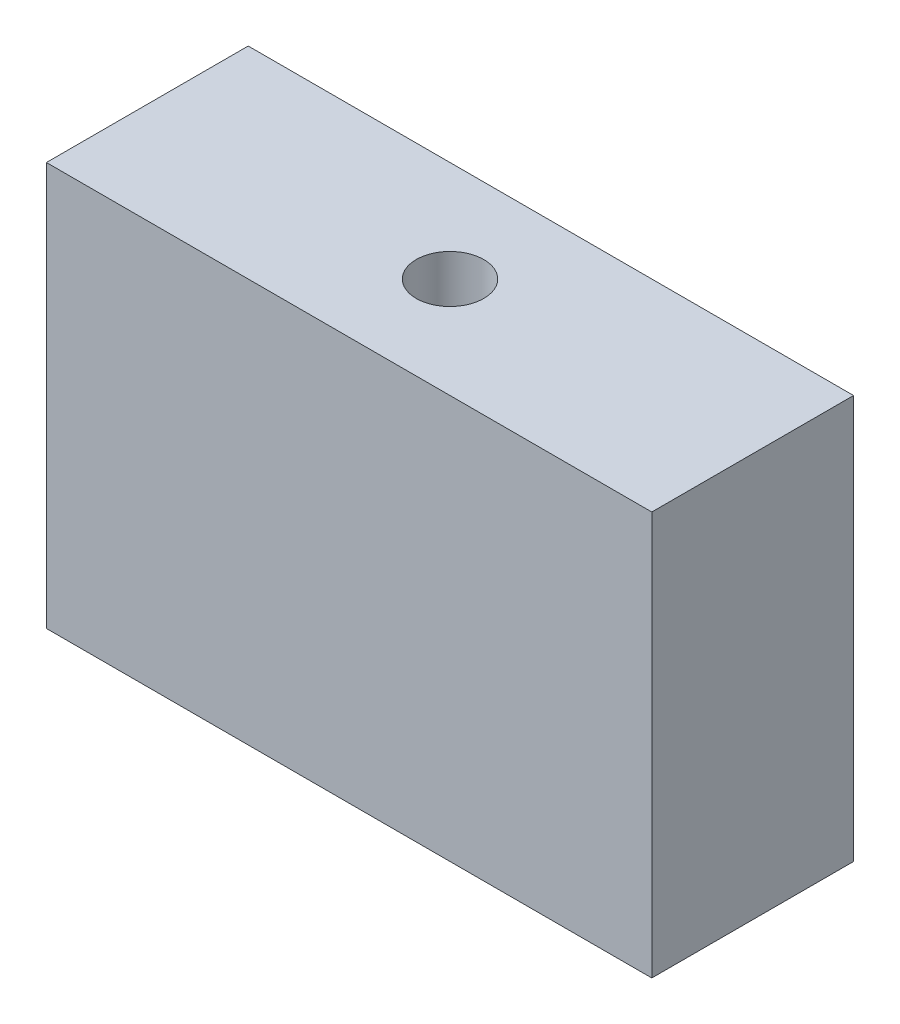
from build123d import *

# Parameters (mm, degrees)
SKETCH1_W           = 76.2
SKETCH1_H           = 25.4
SKETCH1_R           = 4.25
BOSS_EXTRUDE1_DEPTH = 25.4


with BuildPart() as part:
    # Sketch1 → Boss-Extrude1 (new, symmetric)
    with BuildSketch(Plane(origin=(0, 0, 0), x_dir=(1, 0, 0), z_dir=(0, 1, 0))):
        Rectangle(SKETCH1_W, SKETCH1_H)
        with Locations(Location((0, 0, 0), (0, 0, 270))):
            Circle(SKETCH1_R, mode=Mode.SUBTRACT)
    extrude(amount=BOSS_EXTRUDE1_DEPTH, both=True)


solid = part.part
